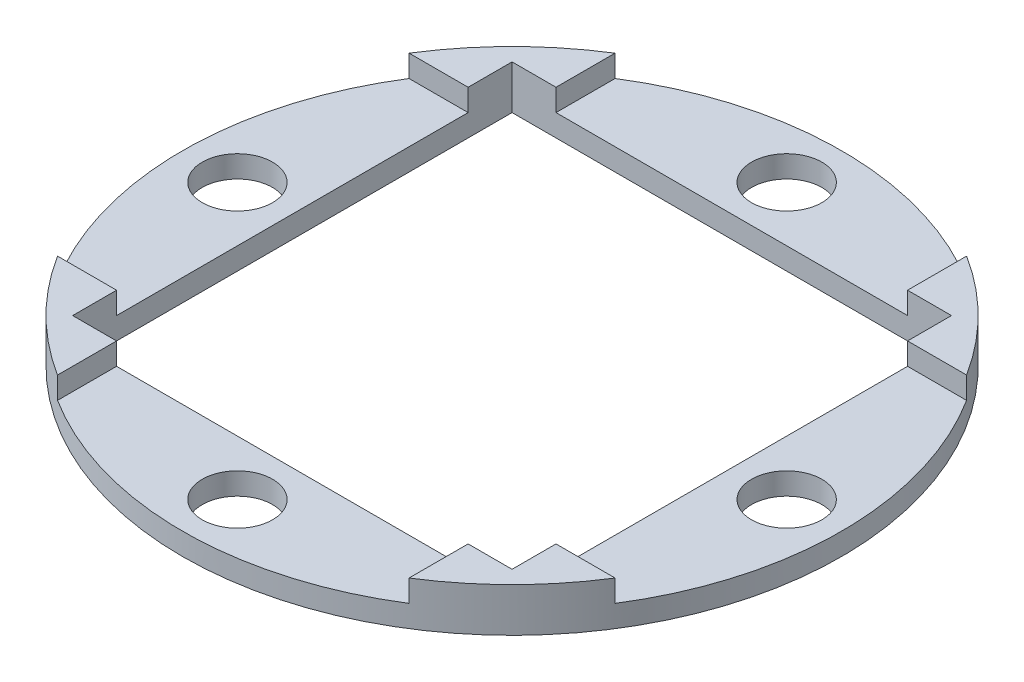
from build123d import *

# Parameters (mm, degrees)
SKETCH1_R           = 75
SKETCH1_W           = 100
SKETCH1_H           = 100
BOSS_EXTRUDE1_DEPTH = 5
SKETCH2_R           = 8
CUT_EXTRUDE1_DEPTH  = 10
BOSS_EXTRUDE2_DEPTH = 5


with BuildPart() as part:
    # Sketch1 → Boss-Extrude1 (new body)
    with BuildSketch(Plane(origin=(0, 0, 0), x_dir=(1, 0, 0), z_dir=(0, 1, 0))):
        with Locations(Location((0, 0, 0), (0, 0, 270))):
            Circle(SKETCH1_R)
        Rectangle(SKETCH1_W, SKETCH1_H, mode=Mode.SUBTRACT)
    extrude(amount=BOSS_EXTRUDE1_DEPTH)

    # Sketch2 → Cut-Extrude1 (cut)
    with BuildSketch(Plane(origin=(0, 5, 0), x_dir=(1, 0, 0), z_dir=(0, 1, 0))):
        with Locations(Location((-62.5, 0, 0), (0, 0, 270))):
            Circle(SKETCH2_R)
        with Locations(Location((0, 62.5, 0), (0, 0, 270))):
            Circle(SKETCH2_R)
        with Locations(Location((62.5, 0, 0), (0, 0, 270))):
            Circle(SKETCH2_R)
        with Locations(Location((0, -62.5, 0), (0, 0, 270))):
            Circle(SKETCH2_R)
    extrude(amount=-CUT_EXTRUDE1_DEPTH, mode=Mode.SUBTRACT)

    # Sketch3 → Boss-Extrude2 (add)
    with BuildSketch(Plane(origin=(0, 5, 0), x_dir=(1, 0, 0), z_dir=(0, 1, 0))):
        with BuildLine():
            Line((50, -50), (40, -50))
            Line((40, -50), (40, -63.442887702))
            ThreePointArc((40, -63.442887702), (53.033008589, -53.033008589), (63.442887702, -40))
            Line((63.442887702, -40), (50, -40))
            Line((50, -40), (50, -50))
        make_face()
        with BuildLine():
            Line((-40, -50), (-50, -50))
            Line((-50, -50), (-50, -40))
            Line((-50, -40), (-63.442887702, -40))
            ThreePointArc((-63.442887702, -40), (-53.033008589, -53.033008589), (-40, -63.442887702))
            Line((-40, -63.442887702), (-40, -50))
        make_face()
        with BuildLine():
            Line((-63.442887702, 40), (-50, 40))
            Line((-50, 40), (-50, 50))
            Line((-50, 50), (-40, 50))
            Line((-40, 50), (-40, 63.442887702))
            ThreePointArc((-40, 63.442887702), (-53.033008589, 53.033008589), (-63.442887702, 40))
        make_face()
        with BuildLine():
            Line((50, 50), (50, 40))
            Line((50, 40), (63.442887702, 40))
            ThreePointArc((63.442887702, 40), (53.033008589, 53.033008589), (40, 63.442887702))
            Line((40, 63.442887702), (40, 50))
            Line((40, 50), (50, 50))
        make_face()
    extrude(amount=BOSS_EXTRUDE2_DEPTH)


solid = part.part
